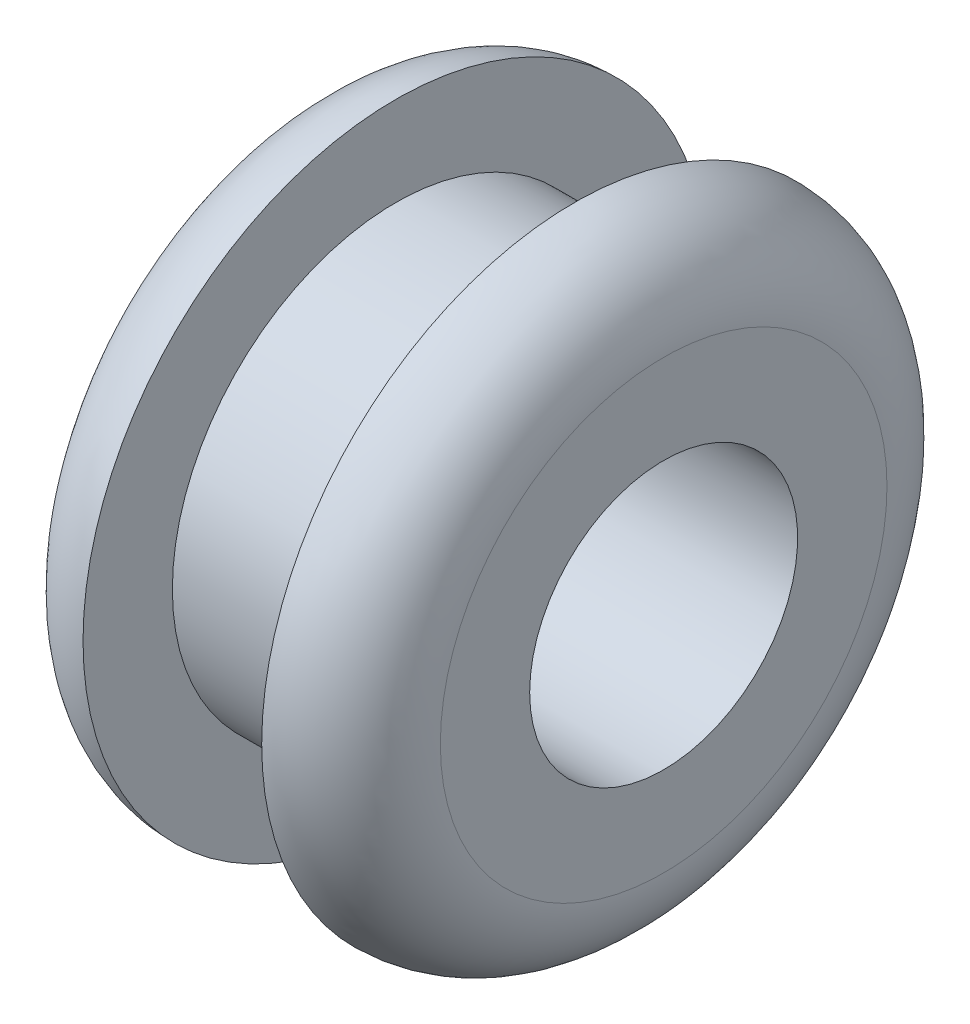
from build123d import *


with BuildPart() as part:
    # Sketch1 → Revolve1 (revolve)
    with BuildSketch(Plane.XY):
        with BuildLine():
            Line((-3.175, 2.38125), (3.175, 2.38125))
            Line((3.175, 2.38125), (3.175, 3.96875))
            ThreePointArc((3.175, 3.96875), (2.710032015, 5.091282015), (1.5875, 5.55625))
            Line((1.5875, 5.55625), (1.5875, 3.96875))
            Line((1.5875, 3.96875), (-1.5875, 3.96875))
            Line((-1.5875, 3.96875), (-1.5875, 5.55625))
            ThreePointArc((-1.5875, 5.55625), (-2.710032015, 5.091282015), (-3.175, 3.96875))
            Line((-3.175, 3.96875), (-3.175, 2.38125))
        make_face()
    revolve(axis=Axis((-4.911678735, 0, 0), (1, 0, 0)))


solid = part.part
